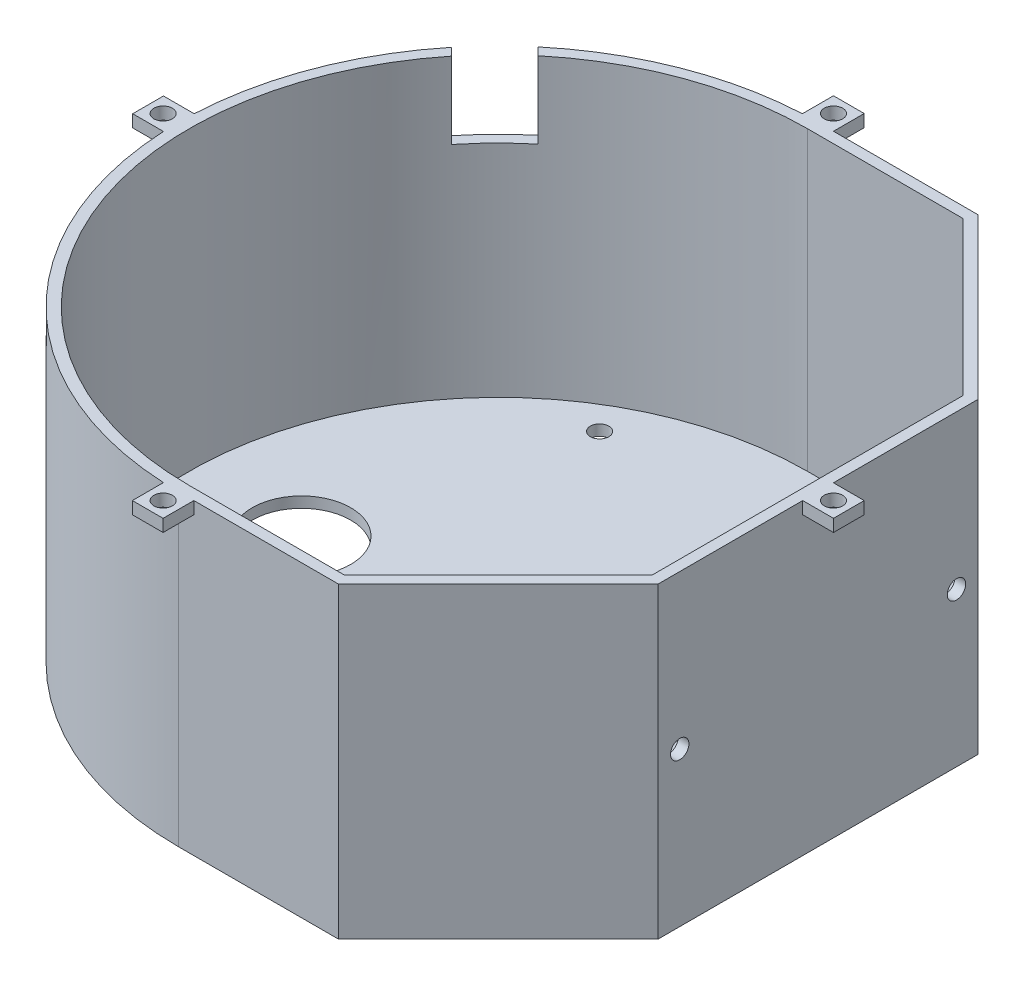
from build123d import *

# Parameters (mm, degrees)
EXTRUDE_5_DEPTH     = 50
SHELL_4_T           = -1.75
SKETCH_3_R          = 8
SKETCH_3_R_2        = 1.5
CUT_EXTRUDE_2_DEPTH = 5
SKETCH_5_R          = 1.5
CUT_EXTRUDE_3_DEPTH = 5
SKETCH_6_W          = 5
SKETCH_6_H          = 5
SKETCH_6_R          = 1.5
SKETCH_6_H_2        = 5.539841266
EXTRUDE_8_DEPTH     = 2
SKETCH_9_W          = 9.945628491
SKETCH_9_H          = 14.246438642
CUT_EXTRUDE_4_DEPTH = 15


with BuildPart() as part:
    # 草图1 → 凸台-拉伸5 (new body)
    with BuildSketch(Plane(origin=(0, 0, 0), x_dir=(1, 0, 0), z_dir=(0, 1, 0))):
        with BuildLine():
            Line((0, -52), (26, -52))
            Line((26, -52), (52, -26))
            Line((52, -26), (52, 26))
            Line((52, 26), (26, 52))
            Line((26, 52), (0, 52))
            ThreePointArc((0, 52), (-52, 0), (0, -52))
        make_face()
    extrude(amount=EXTRUDE_5_DEPTH)

    # 抽壳4
    shell_4_openings = [part.faces().sort_by_distance(p)[0] for p in [
        (1.957361837, 50, 0),
    ]]
    offset(amount=SHELL_4_T, openings=shell_4_openings, kind=Kind.INTERSECTION)

    # 草图3 → 切除-拉伸2 (cut)
    with BuildSketch(Plane(origin=(0, 1.75, 0), x_dir=(1, 0, 0), z_dir=(0, 1, 0))):
        with Locations(Location((-32, 0, 0), (0, 0, 270))):
            Circle(SKETCH_3_R)
        with Locations(Location((45, 0, 0), (0, 0, 270))):
            Circle(SKETCH_3_R_2)
        with Locations(Location((-22.5, 38.97114317, 0), (0, 0, 270))):
            Circle(SKETCH_3_R_2)
        with Locations(Location((-22.5, -38.97114317, 0), (0, 0, 270))):
            Circle(SKETCH_3_R_2)
    extrude(amount=-CUT_EXTRUDE_2_DEPTH, mode=Mode.SUBTRACT)

    # 草图5 → 切除-拉伸3 (cut)
    with BuildSketch(Plane(origin=(52, 0, 0), x_dir=(0, 0, -1), z_dir=(1, 0, 0))):
        with Locations((22.5, 25)):
            Circle(SKETCH_5_R)
        with Locations((-22.5, 25)):
            Circle(SKETCH_5_R)
    extrude(amount=-CUT_EXTRUDE_3_DEPTH, mode=Mode.SUBTRACT)

    # 草图6 → 凸台-拉伸8 (add)
    # profile 1 of 4: a face of its own
    with BuildSketch(Plane(origin=(0, 50, 0), x_dir=(1, 0, 0), z_dir=(0, 1, 0))):
        with Locations((54.5, 0)):
            Rectangle(SKETCH_6_W, SKETCH_6_H)
        with Locations(Location((54.5, 0, 0), (0, 0, 270))):
            Circle(SKETCH_6_R, mode=Mode.SUBTRACT)
    # profile 2 of 4: a face of its own
    with BuildSketch(Plane(origin=(0, 50, 0), x_dir=(1, 0, 0), z_dir=(0, 1, 0))):
        with Locations((-54.43986908, 0)):
            Rectangle(SKETCH_6_W, SKETCH_6_H)
        with Locations(Location((-54.5, 0, 0), (0, 0, 270))):
            Circle(SKETCH_6_R, mode=Mode.SUBTRACT)
    # profile 3 of 4: a face of its own
    with BuildSketch(Plane(origin=(0, 50, 0), x_dir=(1, 0, 0), z_dir=(0, 1, 0))):
        Polygon((2.5, 52), (2.5, 57), (-2.5, 57), (-2.5, 52), (-2.5, 51.633473504), (2.5, 51.633473504), align=None)
        with Locations(Location((0, 54.5, 0), (0, 0, 270))):
            Circle(SKETCH_6_R, mode=Mode.SUBTRACT)
    # profile 4 of 4: a face of its own
    with BuildSketch(Plane(origin=(0, 50, 0), x_dir=(1, 0, 0), z_dir=(0, 1, 0))):
        with Locations((0, -54.230079367)):
            Rectangle(SKETCH_6_W, SKETCH_6_H_2)
        with Locations(Location((0, -54.5, 0), (0, 0, 270))):
            Circle(SKETCH_6_R, mode=Mode.SUBTRACT)
    extrude(amount=-EXTRUDE_8_DEPTH)

    # 草图9 → 切除-拉伸4 (cut)
    with BuildSketch(Plane(origin=(-29.751362544, 0, -29.718537282), x_dir=(-0.7067163758191224, 0, 0.707496971123612), z_dir=(-0.707496971123612, 0, -0.7067163758191224))):
        with Locations((0.350985127, 44.684979675)):
            Rectangle(SKETCH_9_W, SKETCH_9_H)
    extrude(amount=CUT_EXTRUDE_4_DEPTH, mode=Mode.SUBTRACT)


solid = part.part
